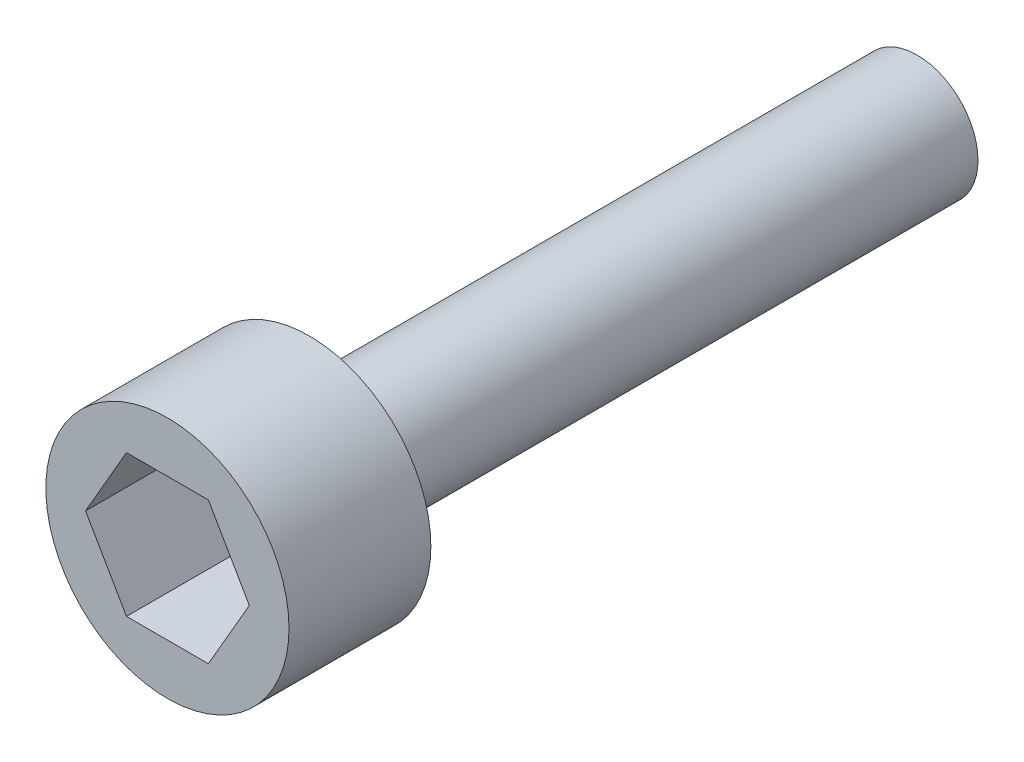
from build123d import *

# Parameters (mm, degrees)
SKETCH1_R                   = 3
HEAD_BOSS_EXTRUDE1_DEPTH    = 3.5
HEAD_HEX_CUT_EXTRUDE1_DEPTH = 2.8
SKETCH2_R                   = 1.5
SCREW_BOSS_EXTRUDE2_DEPTH   = 15


with BuildPart() as part:
    # Sketch1 → Head Boss-Extrude1 (new body)
    with BuildSketch(Plane.XY):
        Circle(SKETCH1_R)
    extrude(amount=HEAD_BOSS_EXTRUDE1_DEPTH)

    # Sketch3 → Head Hex Cut-Extrude1 (cut)
    with BuildSketch(Plane.XY.offset(3.5)):
        Polygon((-1.010362971, 1.75), (1.010362971, 1.75), (2.020725942, 0), (1.010362971, -1.75), (-1.010362971, -1.75), (-2.020725942, 0), align=None)
    extrude(amount=-HEAD_HEX_CUT_EXTRUDE1_DEPTH, mode=Mode.SUBTRACT)

    # Sketch2 → Screw Boss-Extrude2 (add)
    with BuildSketch(Plane.XY):
        Circle(SKETCH2_R)
    extrude(amount=-SCREW_BOSS_EXTRUDE2_DEPTH)


solid = part.part
